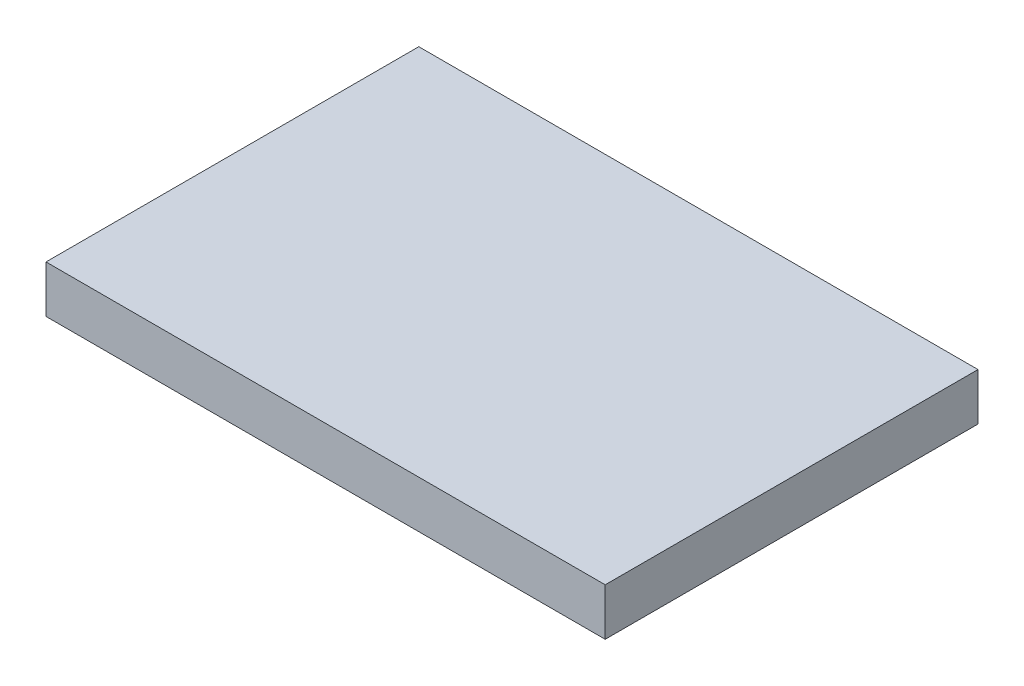
from build123d import *

# Parameters (mm, degrees)
SKETCH1_W           = 450
SKETCH1_H           = 300
BOSS_EXTRUDE1_DEPTH = 38
SHELL1_T            = -4


with BuildPart() as part:
    # Sketch1 → Boss-Extrude1 (new body)
    with BuildSketch(Plane(origin=(0, 0, 0), x_dir=(1, 0, 0), z_dir=(0, 1, 0))):
        Rectangle(SKETCH1_W, SKETCH1_H)
    extrude(amount=BOSS_EXTRUDE1_DEPTH)

    # Shell1
    shell1_openings = [part.faces().sort_by_distance(p)[0] for p in [
        (0, 0, 0),
    ]]
    offset(amount=SHELL1_T, openings=shell1_openings, kind=Kind.INTERSECTION)


solid = part.part
